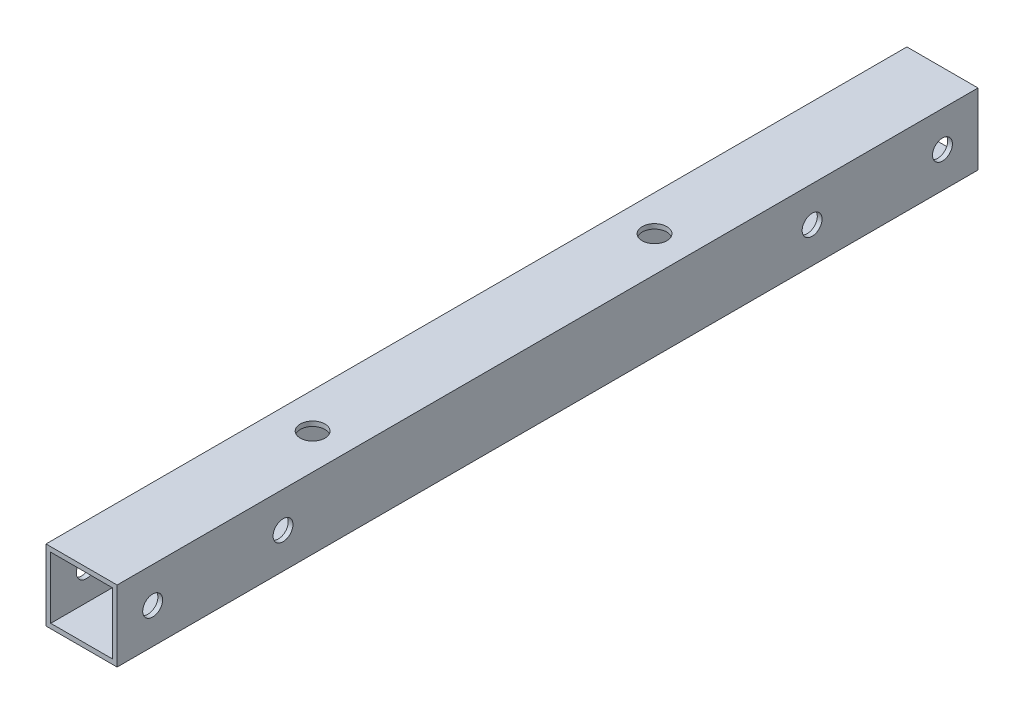
from build123d import *

# Parameters (mm, degrees)
SKETCH_1_W          = 15
SKETCH_1_H          = 15
SKETCH_1_W_2        = 13
SKETCH_1_H_2        = 13
EXTRUDE_1_DEPTH     = 181.6
SKETCH_2_R          = 2.6
CUT_EXTRUDE_1_DEPTH = 183.372722741
SKETCH_3_R          = 2.1
CUT_EXTRUDE_2_DEPTH = 183.372722741


with BuildPart() as part:
    # ｽｹｯﾁ1 → 押し出し-薄板1 (new body)
    with BuildSketch(Plane.XY):
        Rectangle(SKETCH_1_W, SKETCH_1_H)
        Rectangle(SKETCH_1_W_2, SKETCH_1_H_2, mode=Mode.SUBTRACT)
    extrude(amount=EXTRUDE_1_DEPTH)

    # ｽｹｯﾁ2 → ｶｯﾄ - 押し出し1 (cut, through all)
    with BuildSketch(Plane(origin=(0, 7.5, 0), x_dir=(1, 0, 0), z_dir=(0, 1, 0))):
        with Locations(Location((0, -132.86, 0), (0, 0, 180))):
            Circle(SKETCH_2_R)
        with Locations(Location((0, -60.74, 0), (0, 0, 180))):
            Circle(SKETCH_2_R)
    extrude(amount=-CUT_EXTRUDE_1_DEPTH, mode=Mode.SUBTRACT)

    # ｽｹｯﾁ3 → ｶｯﾄ - 押し出し2 (cut, through all)
    with BuildSketch(Plane.ZY.offset(7.5)):
        with Locations(Location((174.1, 0, 0), (0, 0, 270))):
            Circle(SKETCH_3_R)
        with Locations(Location((146.6, 0, 0), (0, 0, 270))):
            Circle(SKETCH_3_R)
        with Locations(Location((35, 0, 0), (0, 0, 270))):
            Circle(SKETCH_3_R)
        with Locations(Location((7.5, 0, 0), (0, 0, 270))):
            Circle(SKETCH_3_R)
    extrude(amount=-CUT_EXTRUDE_2_DEPTH, mode=Mode.SUBTRACT)


solid = part.part
